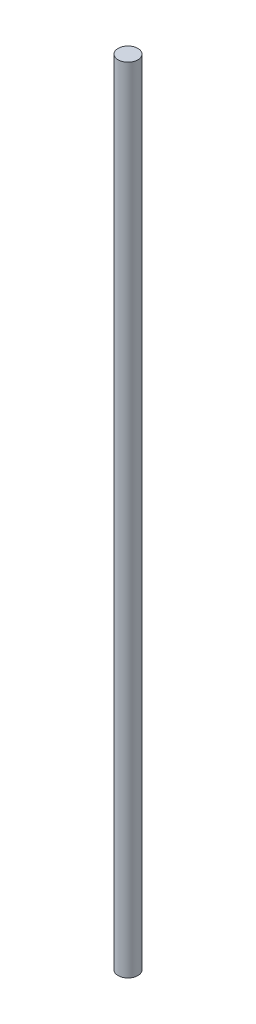
from build123d import *

# Parameters (mm, degrees)
SZKIC1_R                    = 5
DODANIE_WYCI_GNI_CIE1_DEPTH = 400


with BuildPart() as part:
    # Szkic1 → Dodanie-wyciągnięcie1 (new body)
    with BuildSketch(Plane(origin=(0, 0, 0), x_dir=(1, 0, 0), z_dir=(0, 1, 0))):
        with Locations(Location((0, 0, 0), (0, 0, 270))):
            Circle(SZKIC1_R)
    extrude(amount=DODANIE_WYCI_GNI_CIE1_DEPTH)


solid = part.part
